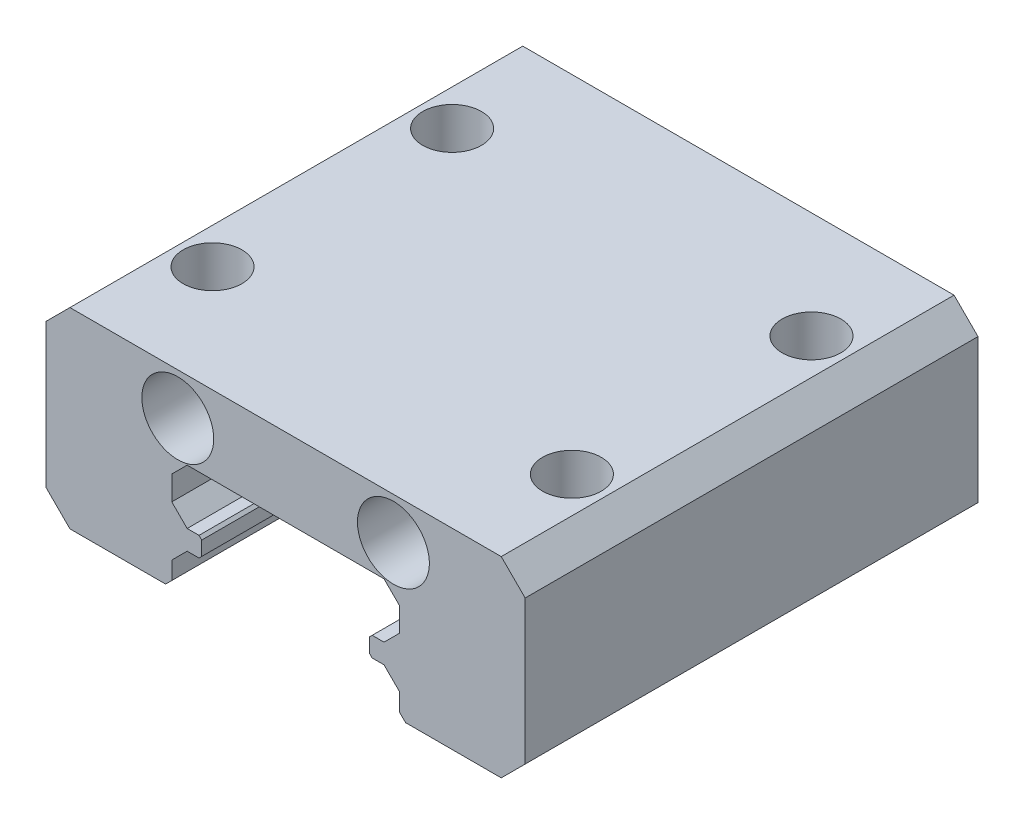
from build123d import *

# Parameters (mm, degrees)
BOSS_EXTRUDE1_DEPTH = 9.45
SKETCH3_R           = 1.5
CUT_EXTRUDE1_DEPTH  = 3
SKETCH4_R           = 1.226272584
CUT_EXTRUDE2_DEPTH  = 3


with BuildPart() as part:
    # Sketch2 → Boss-Extrude1 (new, symmetric)
    with BuildSketch(Plane.XY):
        Polygon((-4.108578644, 6.75), (4.108578644, 6.75), (4.75, 6.108578644), (4.75, 5.101471863), (4.108578644, 4.460050506), (3.613603897, 4.460050506), (3.5, 4.346446609), (3.5, 3.753553391), (3.613603897, 3.639949494), (4.108578644, 3.639949494), (4.75, 2.998528137), (4.75, 2.257905525), (5.007905525, 2), (9.001471863, 2), (10, 2.998528137), (10, 9.001471863), (9.001471863, 10), (-9.001471863, 10), (-10, 9.001471863), (-10, 2.998528137), (-9.001471863, 2), (-5.007905525, 2), (-4.75, 2.257905525), (-4.75, 2.998528137), (-4.108578644, 3.639949494), (-3.613603897, 3.639949494), (-3.5, 3.753553391), (-3.5, 4.346446609), (-3.613603897, 4.460050506), (-4.108578644, 4.460050506), (-4.75, 5.101471863), (-4.75, 6.108578644), align=None)
    extrude(amount=BOSS_EXTRUDE1_DEPTH, both=True)

    # Sketch3 → Cut-Extrude1 (cut)
    with BuildSketch(Plane.XY.offset(9.45)):
        with Locations((-4.5, 8.25)):
            Circle(SKETCH3_R)
        with Locations(Location((4.5, 8.25, 0), (0, 0, 180))):
            Circle(SKETCH3_R)
    cut_extrude1 = extrude(amount=-CUT_EXTRUDE1_DEPTH, mode=Mode.SUBTRACT)

    # Mirror1: Cut-Extrude1 across plane
    add(cut_extrude1.mirror(Plane.XY), mode=Mode.SUBTRACT)

    # Sketch4 → Cut-Extrude2 (cut)
    with BuildSketch(Plane(origin=(0, 10, 0), x_dir=(1, 0, 0), z_dir=(0, 1, 0))):
        with Locations(Location((7.5, -5, 0), (0, 0, 270))):
            Circle(SKETCH4_R)
        with Locations(Location((-7.5, -5, 0), (0, 0, 90))):
            Circle(SKETCH4_R)
        with Locations(Location((-7.5, 5, 0), (0, 0, 270))):
            Circle(SKETCH4_R)
        with Locations(Location((7.5, 5, 0), (0, 0, 90))):
            Circle(SKETCH4_R)
    extrude(amount=-CUT_EXTRUDE2_DEPTH, mode=Mode.SUBTRACT)


solid = part.part
